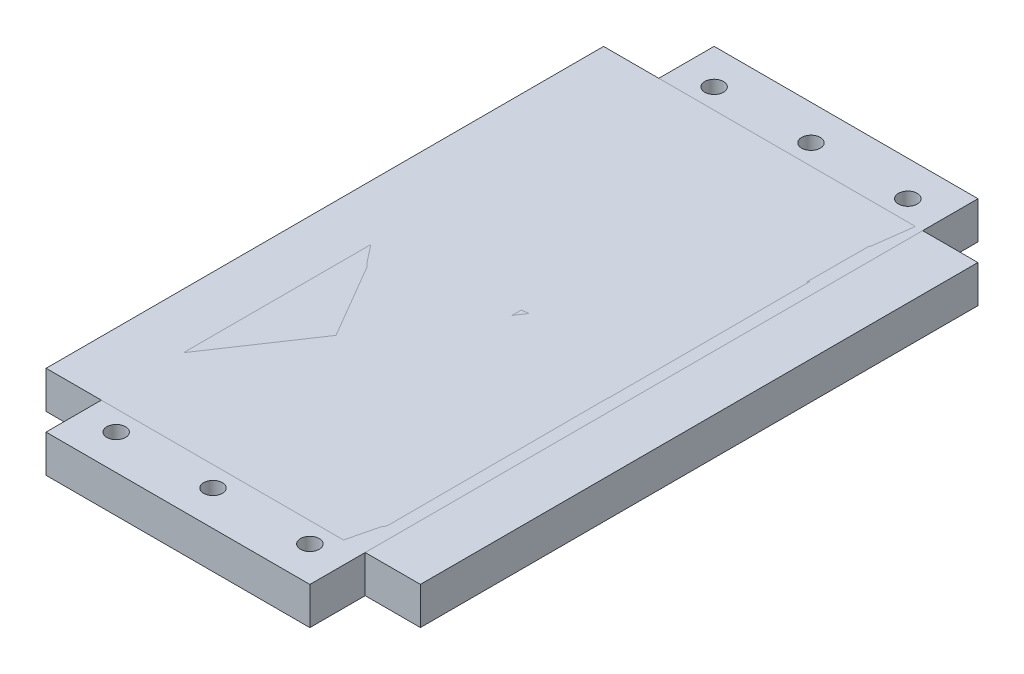
from build123d import *

# Parameters (mm, degrees)
SKETCH1_W           = 56.4
SKETCH1_H           = 142.8
BOSS_EXTRUDE1_DEPTH = 8
SKETCH2_R           = 16
CUT_EXTRUDE1_DEPTH  = 6
SKETCH3_R           = 10
CUT_EXTRUDE2_DEPTH  = 154.651553848
SKETCH4_R           = 2
CUT_EXTRUDE3_DEPTH  = 154.7426421
SKETCH5_R           = 12
CUT_EXTRUDE4_DEPTH  = 154.7426421
SKETCH6_W           = 80
SKETCH6_H           = 119.15
BOSS_EXTRUDE2_DEPTH = 8
SKETCH9_R           = 2
CUT_EXTRUDE5_DEPTH  = 10
SKETCH10_W          = 29
SKETCH10_H          = 4
CUT_EXTRUDE6_DEPTH  = 3


with BuildPart() as part:
    # Sketch1 → Boss-Extrude1 (new body)
    with BuildSketch(Plane(origin=(0, 0, 0), x_dir=(1, 0, 0), z_dir=(0, 1, 0))):
        with Locations((28.2, -71.4)):
            Rectangle(SKETCH1_W, SKETCH1_H)
    extrude(amount=BOSS_EXTRUDE1_DEPTH)

    # Sketch2 → Cut-Extrude1 (cut)
    with BuildSketch(Plane(origin=(0, 8, 0), x_dir=(1, 0, 0), z_dir=(0, 1, 0))):
        with Locations(Location((28.2, -43.2, 0), (0, 0, 270))):
            Circle(SKETCH2_R)
    extrude(amount=-CUT_EXTRUDE1_DEPTH, mode=Mode.SUBTRACT)

    # Sketch3 → Cut-Extrude2 (cut, through all)
    with BuildSketch(Plane(origin=(0, 2, 0), x_dir=(1, 0, 0), z_dir=(0, 1, 0))):
        with Locations(Location((28.2, -43.2, 0), (0, 0, 270))):
            Circle(SKETCH3_R)
    extrude(amount=-CUT_EXTRUDE2_DEPTH, mode=Mode.SUBTRACT)

    # Sketch4 → Cut-Extrude3 (cut, through all)
    with BuildSketch(Plane(origin=(0, 8, 0), x_dir=(1, 0, 0), z_dir=(0, 1, 0))):
        with Locations(Location((4.58, -19.58, 0), (0, 0, 270))):
            Circle(SKETCH4_R)
        with Locations(Location((51.82, -19.58, 0), (0, 0, 90))):
            Circle(SKETCH4_R)
        with Locations(Location((51.82, -66.82, 0), (0, 0, 270))):
            Circle(SKETCH4_R)
        with Locations(Location((4.58, -66.82, 0), (0, 0, 90))):
            Circle(SKETCH4_R)
    cut_extrude3 = extrude(amount=-CUT_EXTRUDE3_DEPTH, mode=Mode.SUBTRACT)

    # Sketch5 → Cut-Extrude4 (cut, through all)
    with BuildSketch(Plane(origin=(0, 8, 0), x_dir=(1, 0, 0), z_dir=(0, 1, 0))):
        with Locations(Location((28.2, -99.6, 0), (0, 0, 270))):
            Circle(SKETCH5_R)
    extrude(amount=-CUT_EXTRUDE4_DEPTH, mode=Mode.SUBTRACT)

    # Mirror1: Cut-Extrude3 across plane
    add(cut_extrude3.mirror(Plane.XY.offset(71.4)), mode=Mode.SUBTRACT)

    # Sketch9 → Cut-Extrude5 (cut)
    with BuildSketch(Plane(origin=(0, 8, 0), x_dir=(1, 0, 0), z_dir=(0, 1, 0))):
        with Locations(Location((7.5, -7.5, 0), (0, 0, 270))):
            Circle(SKETCH9_R)
        with Locations(Location((28.2, -7.5, 0), (0, 0, 270))):
            Circle(SKETCH9_R)
        with Locations(Location((48.9, -7.5, 0), (0, 0, 270))):
            Circle(SKETCH9_R)
    cut_extrude5 = extrude(amount=-CUT_EXTRUDE5_DEPTH, mode=Mode.SUBTRACT)

    # Mirror2: Cut-Extrude5 across plane
    add(cut_extrude5.mirror(Plane.XY.offset(71.4)), mode=Mode.SUBTRACT)

    # Sketch10 → Cut-Extrude6 (cut)
    with BuildSketch(Plane(origin=(0, 8, 0), x_dir=(1, 0, 0), z_dir=(0, 1, 0))):
        with Locations((13.7, -71.4)):
            Rectangle(SKETCH10_W, SKETCH10_H)
    extrude(amount=-CUT_EXTRUDE6_DEPTH, mode=Mode.SUBTRACT)


with BuildPart() as body_2:
    # Sketch6 → Boss-Extrude2 (new body)
    with BuildSketch(Plane(origin=(0, 8, 0), x_dir=(1, 0, 0), z_dir=(0, 1, 0))):
        with Locations((28.2, -71.4)):
            Rectangle(SKETCH6_W, SKETCH6_H)
    extrude(amount=-BOSS_EXTRUDE2_DEPTH)


solid = Compound([part.part, body_2.part])
